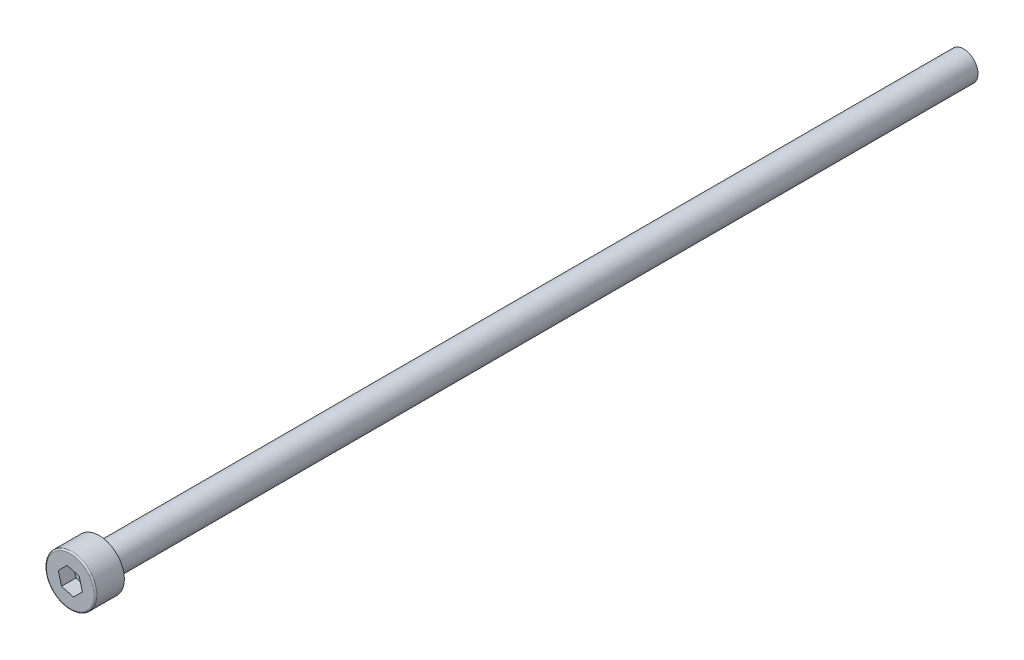
from build123d import *

# Parameters (mm, degrees)
SKETCH_1_R          = 3.5
EXTRUDE_1_DEPTH     = 4
CUT_EXTRUDE_1_DEPTH = 2
SKETCH_3_R          = 2
EXTRUDE_2_DEPTH     = 120
FILLET_1_R          = 0.2


with BuildPart() as part:
    # 草图1 → 凸台-拉伸1 (new body)
    with BuildSketch(Plane.XY):
        Circle(SKETCH_1_R)
    extrude(amount=EXTRUDE_1_DEPTH)

    # 草图2 → 切除-拉伸1 (cut)
    with BuildSketch(Plane.XY.offset(4)):
        Polygon((-1.224744871, -1.224744871), (0.448287736, -1.673032607), (1.673032607, -0.448287736), (1.224744871, 1.224744871), (-0.448287736, 1.673032607), (-1.673032607, 0.448287736), align=None)
    extrude(amount=-CUT_EXTRUDE_1_DEPTH, mode=Mode.SUBTRACT)

    # 草图3 → 凸台-拉伸2 (add)
    with BuildSketch(Plane(origin=(0, 0, 0), x_dir=(-1, 0, 0), z_dir=(0, 0, -1))):
        with Locations(Location((0, 0, 0), (0, 0, 180))):
            Circle(SKETCH_3_R)
    extrude(amount=EXTRUDE_2_DEPTH)

    # 圆角1
    fillet_1_edges = [part.edges().sort_by_distance(p)[0] for p in [
        (-3.5, 0, 4),
    ]]
    fillet(fillet_1_edges, radius=FILLET_1_R)


solid = part.part
